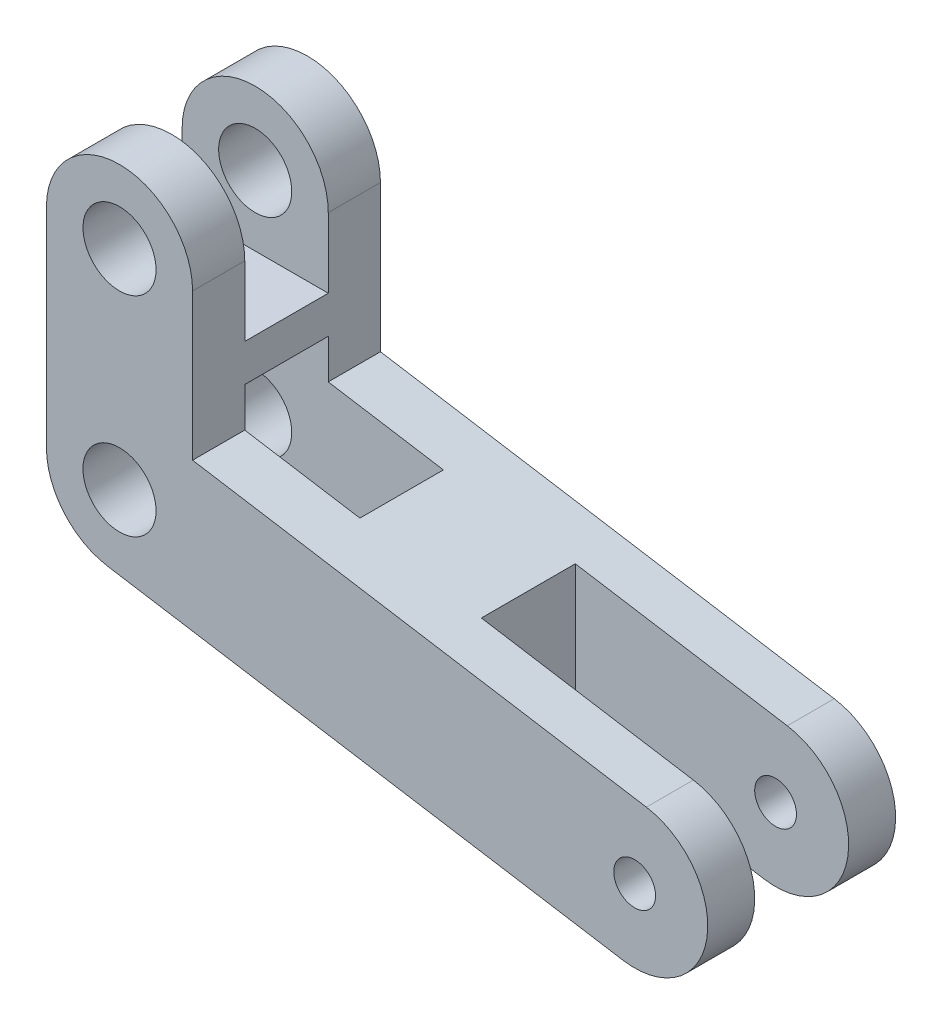
from build123d import *

# Parameters (mm, degrees)
SKETCH_1_R          = 1.75
SKETCH_1_R_2        = 1
EXTRUDE_1_DEPTH     = 4.5
SKETCH_5_W          = 9.199682462
SKETCH_5_H          = 9.813167506
SKETCH_5_W_2        = 14.660354758
SKETCH_5_H_2        = 10.525453646
CUT_EXTRUDE_3_DEPTH = 2
SKETCH_6_W          = 19.186818515
SKETCH_6_H          = 12
CUT_EXTRUDE_4_DEPTH = 2.25


with BuildPart() as part:
    # 草图1 → 凸台-拉伸1 (new, symmetric)
    with BuildSketch(Plane.XY):
        with BuildLine():
            Line((24.117925359, -7.45490955), (-0.56, -3.45490955))
            ThreePointArc((-0.56, -3.45490955), (-2.665520587, -2.268259244), (-3.5, 0))
            Line((-3.5, 0), (-3.5, 10))
            ThreePointArc((-3.5, 10), (0, 13.5), (3.5, 10))
            Line((3.5, 10), (3.5, 2.978370302))
            Line((3.5, 2.978370302), (25.237925359, -0.54509045))
            ThreePointArc((25.237925359, -0.54509045), (28.132834909, -4.56), (24.117925359, -7.45490955))
        make_face()
        Circle(SKETCH_1_R, mode=Mode.SUBTRACT)
        with Locations((0, 10)):
            Circle(SKETCH_1_R, mode=Mode.SUBTRACT)
        with Locations((24.677925359, -4)):
            Circle(SKETCH_1_R_2, mode=Mode.SUBTRACT)
    extrude(amount=EXTRUDE_1_DEPTH, both=True)

    # 草图5 → 切除-拉伸3 (cut, symmetric)
    with BuildSketch(Plane.XY):
        with Locations((-1.099841231, 11.563279791)):
            Rectangle(SKETCH_5_W, SKETCH_5_H)
        with Locations((1.684655549, -0.393377614)):
            Rectangle(SKETCH_5_W_2, SKETCH_5_H_2)
    extrude(amount=CUT_EXTRUDE_3_DEPTH, both=True, mode=Mode.SUBTRACT)

    # 草图6 → 切除-拉伸4 (cut, symmetric)
    with BuildSketch(Plane.XY):
        with Locations((24.677925359, -4)):
            Rectangle(SKETCH_6_W, SKETCH_6_H)
    extrude(amount=CUT_EXTRUDE_4_DEPTH, both=True, mode=Mode.SUBTRACT)


solid = part.part
